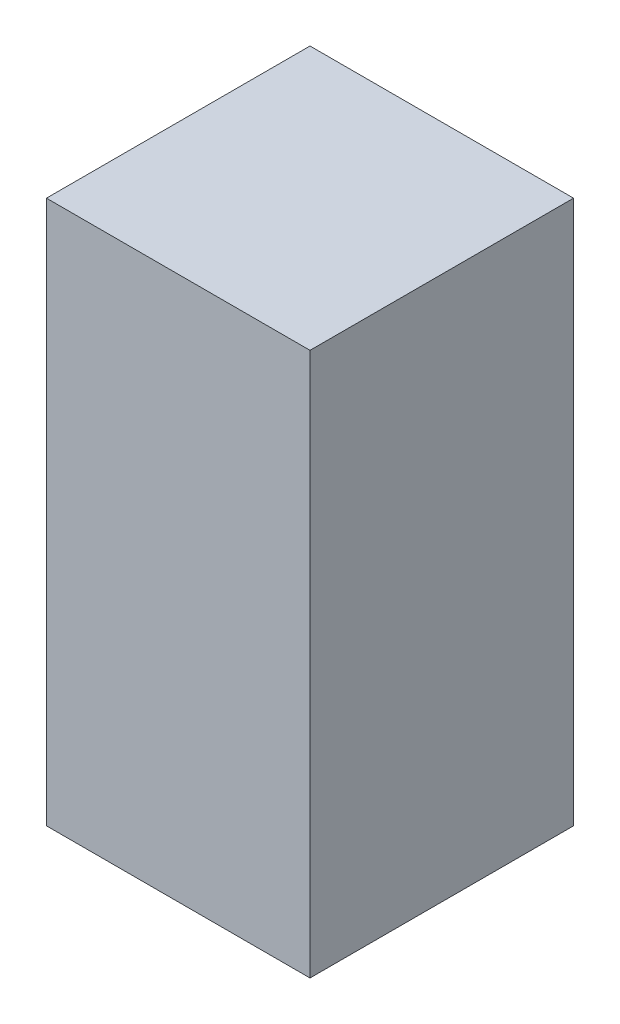
from build123d import *

# Parameters (mm, degrees)
SKETCH1_W           = 168.275
SKETCH1_H           = 168.275
BOSS_EXTRUDE1_DEPTH = 347.07576


with BuildPart() as part:
    # Sketch1 → Boss-Extrude1 (new body)
    with BuildSketch(Plane(origin=(0, 0, 0), x_dir=(1, 0, 0), z_dir=(0, 1, 0))):
        with Locations((84.1375, -84.1375)):
            Rectangle(SKETCH1_W, SKETCH1_H)
    extrude(amount=BOSS_EXTRUDE1_DEPTH)


solid = part.part
